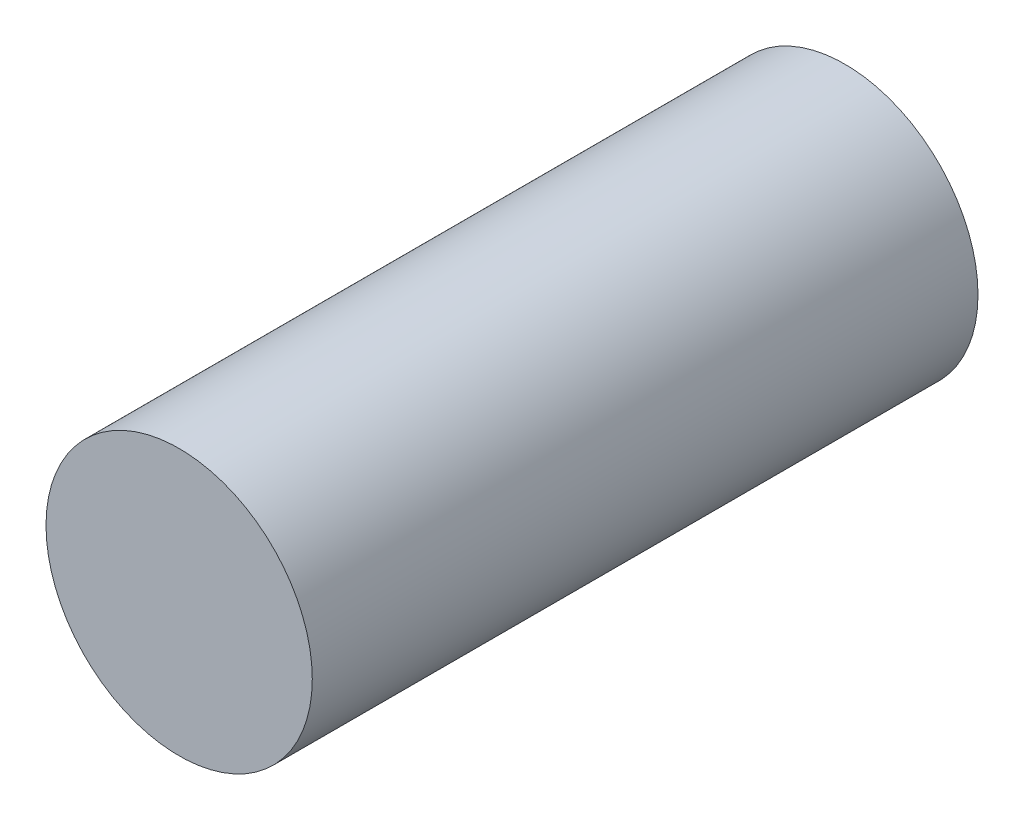
from build123d import *

# Parameters (mm, degrees)
ESBO_O1_R                = 8
RESSALTO_EXTRUS_O1_DEPTH = 40


with BuildPart() as part:
    # Esboço1 → Ressalto-extrusão1 (new body)
    with BuildSketch(Plane.XY):
        Circle(ESBO_O1_R)
    extrude(amount=RESSALTO_EXTRUS_O1_DEPTH)


solid = part.part
